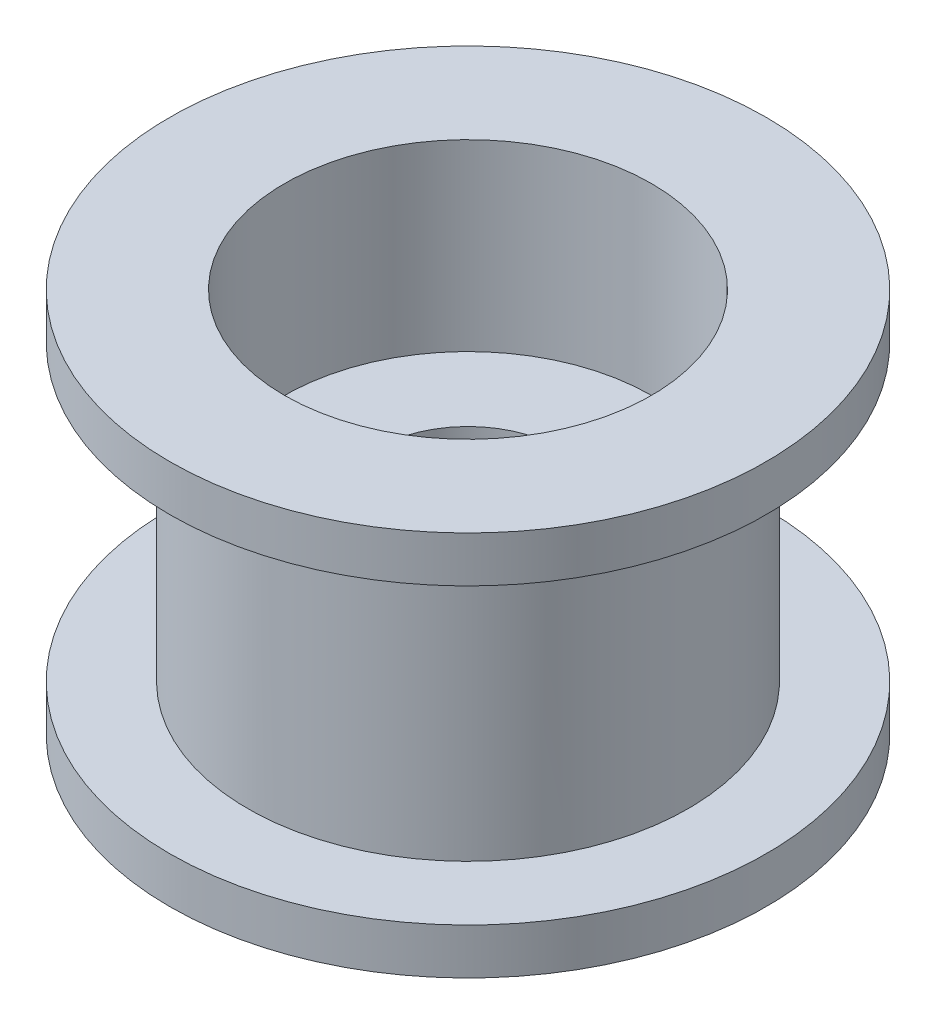
from build123d import *

# Parameters (mm, degrees)
BASES_R        = 4.8
BASE_DEPTH     = 3.2
FLANGES_R      = 6.5
FLANGE_DEPTH   = 1
TOPBORES_R     = 4
TOPBORE_DEPTH  = 4
THRUHOLES_R    = 2
THRUHOLE_DEPTH = 11.191172651


with BuildPart() as part:
    # BaseS → Base (new, symmetric)
    with BuildSketch(Plane(origin=(0, 0, 0), x_dir=(1, 0, 0), z_dir=(0, 1, 0))):
        with Locations(Location((0, 0, 0), (0, 0, 270))):
            Circle(BASES_R)
    extrude(amount=BASE_DEPTH, both=True)

    # FlangeS → Flange (add)
    with BuildSketch(Plane(origin=(0, 3.2, 0), x_dir=(1, 0, 0), z_dir=(0, 1, 0))):
        with Locations(Location((0, 0, 0), (0, 0, 270))):
            Circle(FLANGES_R)
    flange = extrude(amount=FLANGE_DEPTH)

    # TopBoreS → TopBore (cut)
    with BuildSketch(Plane(origin=(0, 4.2, 0), x_dir=(1, 0, 0), z_dir=(0, 1, 0))):
        with Locations(Location((0, 0, 0), (0, 0, 270))):
            Circle(TOPBORES_R)
    topbore = extrude(amount=-TOPBORE_DEPTH, mode=Mode.SUBTRACT)

    # BoreVM: Flange, TopBore across plane
    add(flange.mirror(Plane.ZX))
    add(topbore.mirror(Plane.ZX), mode=Mode.SUBTRACT)

    # ThruHoleS → ThruHole (cut, through all)
    with BuildSketch(Plane(origin=(0, 0.2, 0), x_dir=(1, 0, 0), z_dir=(0, 1, 0))):
        with Locations(Location((0, 0, 0), (0, 0, 270))):
            Circle(THRUHOLES_R)
    extrude(amount=-THRUHOLE_DEPTH, mode=Mode.SUBTRACT)


solid = part.part
